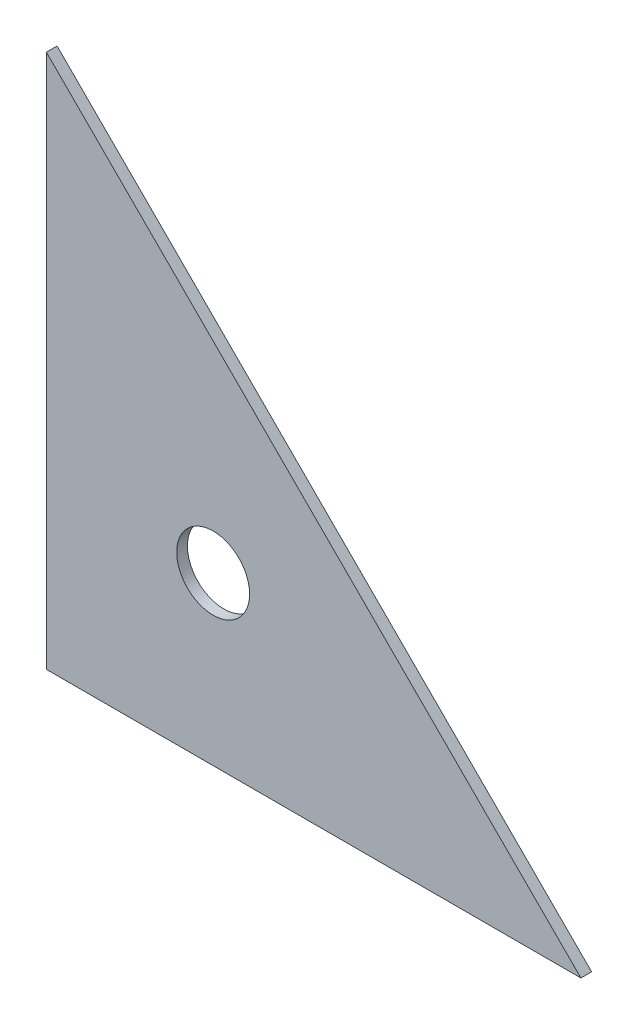
from build123d import *

# Parameters (mm, degrees)
SKETCH1_R           = 1.705
BOSS_EXTRUDE1_DEPTH = 0.5


with BuildPart() as part:
    # Sketch1 → Boss-Extrude1 (new body)
    with BuildSketch(Plane.XY):
        Polygon((0, 0), (0, 25), (25, 0), align=None)
        with Locations((7.8, 7.8)):
            Circle(SKETCH1_R, mode=Mode.SUBTRACT)
    extrude(amount=BOSS_EXTRUDE1_DEPTH)


solid = part.part
